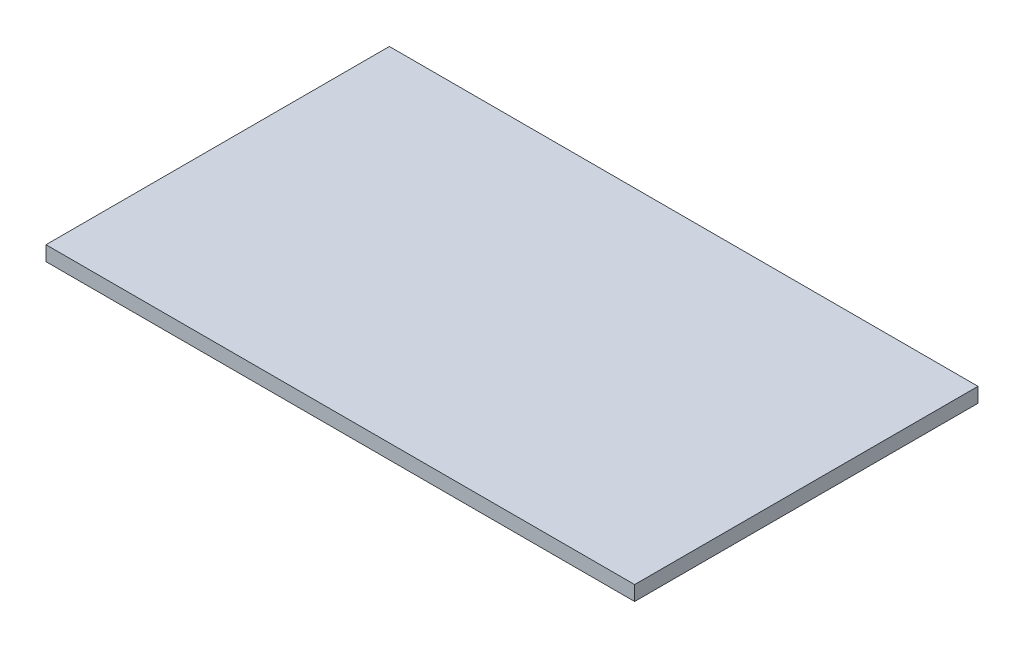
from build123d import *

# Parameters (mm, degrees)
SKETCH1_W           = 60
SKETCH1_H           = 35
BOSS_EXTRUDE1_DEPTH = 1.5


with BuildPart() as part:
    # Sketch1 → Boss-Extrude1 (new body)
    with BuildSketch(Plane(origin=(0, 0, 0), x_dir=(1, 0, 0), z_dir=(0, 1, 0))):
        Rectangle(SKETCH1_W, SKETCH1_H)
    extrude(amount=BOSS_EXTRUDE1_DEPTH)


solid = part.part
